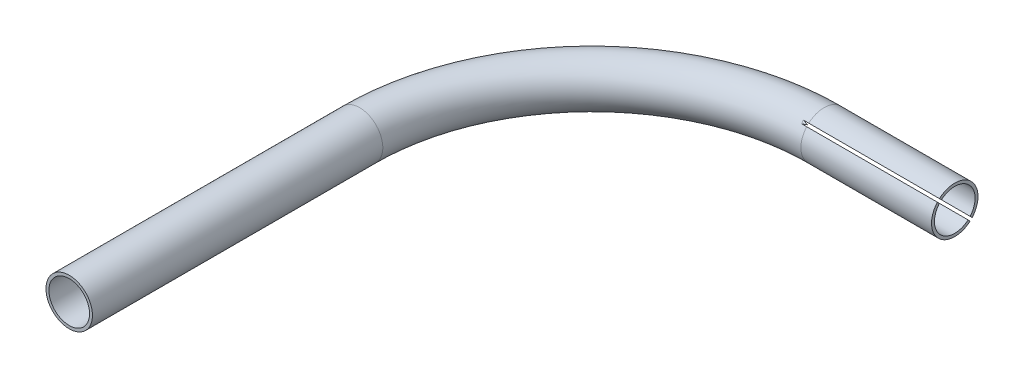
from build123d import *

# Parameters (mm, degrees)
SKETCH_2_R          = 8
SKETCH_2_R_2        = 7
CUT_EXTRUDE_1_DEPTH = 70


with BuildPart() as part:
    # По траектории1: sweep along a path in Эскиз1
    with BuildLine(Plane(origin=(0, 0, 0), x_dir=(1, 0, 0), z_dir=(0, 1, 0))) as sweep_1_path:
        Line((-125, -180), (-125, -80))
        ThreePointArc((-125, -80), (-101.568542495, -23.431457505), (-45, 0))
        Line((-45, 0), (0, 0))
    # Эскиз2 → По траектории1 (sweep)
    with BuildSketch(Plane(origin=(0, 0, 0), x_dir=(0, 0, -1), z_dir=(1, 0, 0))):
        Circle(SKETCH_2_R)
        Circle(SKETCH_2_R_2, mode=Mode.SUBTRACT)
    sweep(path=sweep_1_path.line)

    # Эскиз3 → Вырез-Вытянуть1 (cut)
    with BuildSketch(Plane(origin=(0, 0, 0), x_dir=(0, 0, -1), z_dir=(1, 0, 0))):
        Polygon((5.303300859, -6.01040764), (-6.01040764, 5.303300859), (-5.303300859, 6.01040764), (6.01040764, -5.303300859), align=None)
    extrude(amount=-CUT_EXTRUDE_1_DEPTH, mode=Mode.SUBTRACT)


solid = part.part
